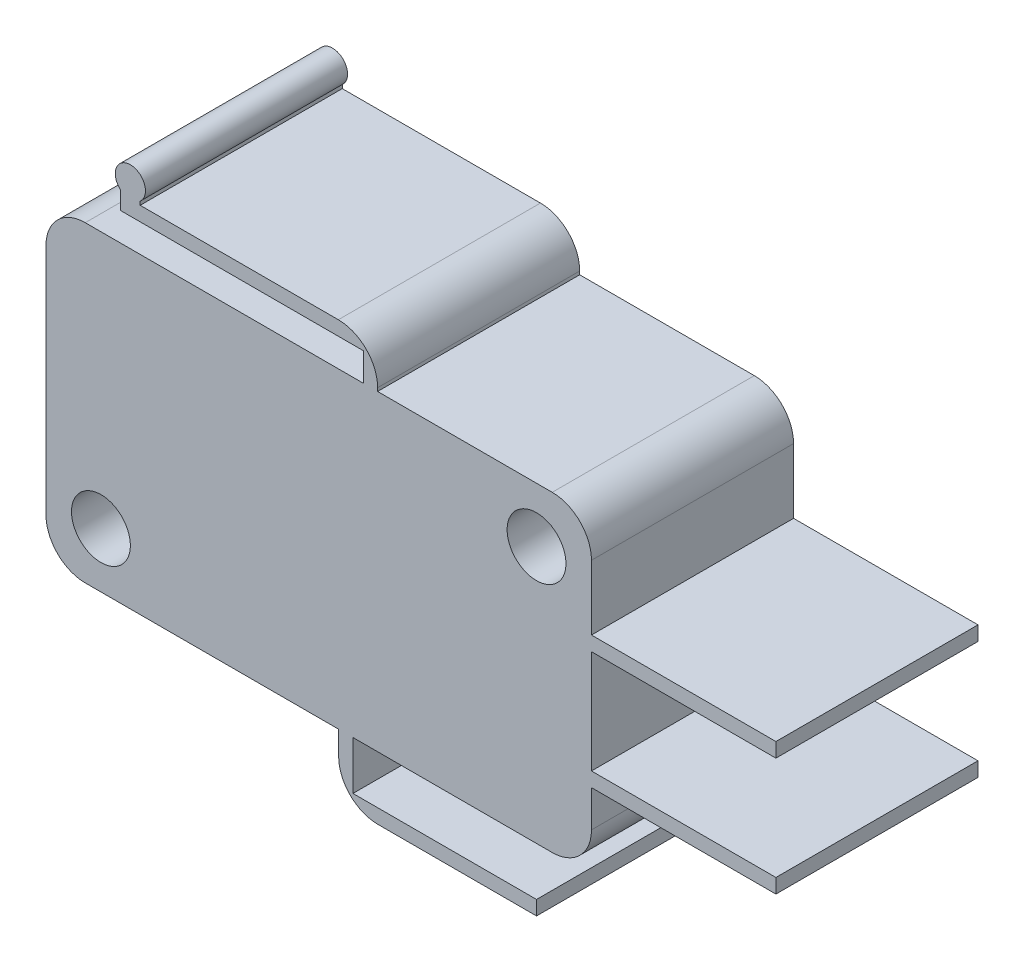
from build123d import *

# Parameters (mm, degrees)
IZIM1_R                     = 1.5
Y_KSEKLIK_EKSTR_ZYON1_DEPTH = 10.3
RADYUS2_R                   = 2
IZIM4_R                     = 0.77
Y_KSEKLIK_EKSTR_ZYON2_DEPTH = 10.3


with BuildPart() as part:
    # Çizim1 → Yükseklik-Ekstrüzyon1 (new body)
    with BuildSketch(Plane.XY):
        with BuildLine():
            Line((13.9, -4.084784969), (22.330620506, -4.084784969))
            Line((22.330620506, -4.084784969), (23.3, -4.084784969))
            Line((23.3, -4.084784969), (23.3, -3.910005756))
            Line((23.3, -3.910005756), (23.3, -3.608421024))
            Line((23.3, -3.608421024), (23.3, -3.349919826))
            Line((23.3, -3.349919826), (22.330620506, -3.349919826))
            Line((22.330620506, -3.349919826), (13.9, -3.349919826))
            Line((13.9, -3.349919826), (13.9, 1.915215031))
            Line((13.9, 1.915215031), (22.330620506, 1.915215031))
            Line((22.330620506, 1.915215031), (23.3, 1.915215031))
            Line((23.3, 1.915215031), (23.3, 2.089994244))
            Line((23.3, 2.089994244), (23.3, 2.391578976))
            Line((23.3, 2.391578976), (23.3, 2.650080174))
            Line((23.3, 2.650080174), (22.330620506, 2.650080174))
            Line((22.330620506, 2.650080174), (13.9, 2.650080174))
            Line((13.9, 2.650080174), (13.9, 7.95))
            Line((13.9, 7.95), (3, 7.95))
            Line((3, 7.95), (3, 10.116757373))
            Line((3, 10.116757373), (-9.1, 10.116757373))
            Line((-9.1, 10.116757373), (-9.1, 10.886757373))
            ThreePointArc((-9.1, 10.886757373), (-9.6, 11.386757373), (-10.1, 10.886757373))
            Line((-10.1, 10.886757373), (-10.1, 9.386757373))
            Line((-10.1, 9.386757373), (-9.1, 9.386757373))
            Line((-9.1, 9.386757373), (2.27, 9.386757373))
            Line((2.27, 9.386757373), (2.27, 7.95))
            Line((2.27, 7.95), (-13.9, 7.95))
            Line((-13.9, 7.95), (-13.9, -7.95))
            Line((-13.9, -7.95), (1.014637994, -7.95))
            Line((1.014637994, -7.95), (1.014637994, -11.15))
            Line((1.014637994, -11.15), (11.1, -11.15))
            Line((11.1, -11.15), (11.1, -10.42))
            Line((11.1, -10.42), (1.744637994, -10.42))
            Line((1.744637994, -10.42), (1.744637994, -7.95))
            Line((1.744637994, -7.95), (13.9, -7.95))
            Line((13.9, -7.95), (13.9, -4.084784969))
        make_face()
        with Locations(Location((11.1, 5.15, 0), (0, 0, 180))):
            Circle(IZIM1_R, mode=Mode.SUBTRACT)
        with Locations(Location((-11.1, -5.15, 0), (0, 0, 180))):
            Circle(IZIM1_R, mode=Mode.SUBTRACT)
    extrude(amount=Y_KSEKLIK_EKSTR_ZYON1_DEPTH)

    # Radyus2
    radyus2_edges = [part.edges().sort_by_distance(p)[0] for p in [
        (1.014637994, -11.15, 5.15),
        (-13.9, -7.95, 5.15),
        (-13.9, 7.95, 5.15),
        (3, 10.116757373, 5.15),
        (13.9, 7.95, 5.15),
        (13.9, -7.95, 5.15),
    ]]
    fillet(radyus2_edges, radius=RADYUS2_R)

    # Çizim4 → Yükseklik-Ekstrüzyon2 (add)
    with BuildSketch(Plane.XY.offset(10.3)):
        with Locations((-9.6, 10.886757373)):
            Circle(IZIM4_R)
    extrude(amount=-Y_KSEKLIK_EKSTR_ZYON2_DEPTH)


solid = part.part
